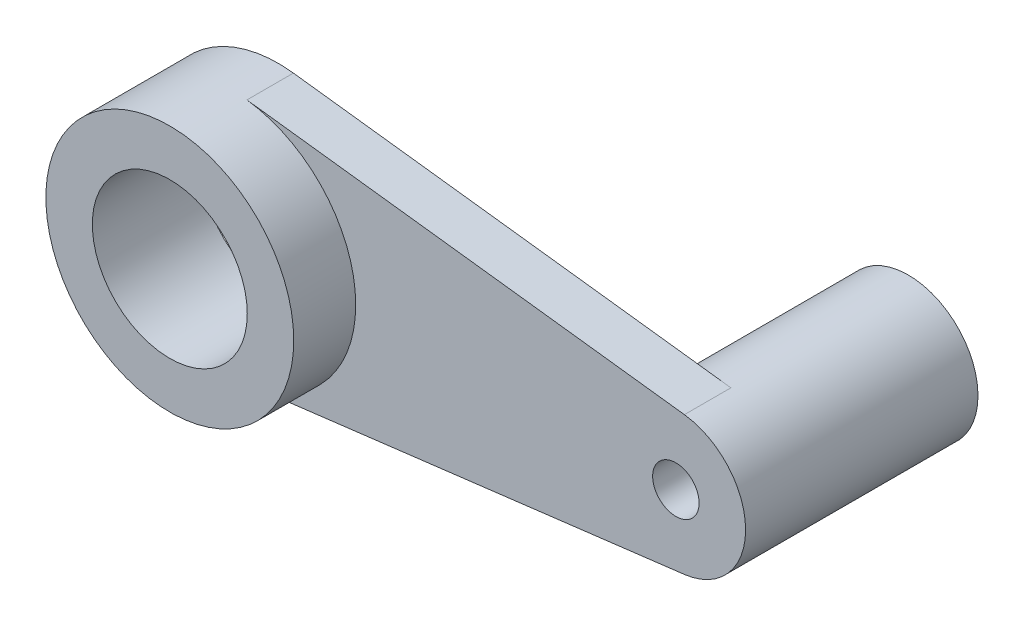
from build123d import *

# Parameters (mm, degrees)
SKETCH3_R                = 10
BOSS_EXTRUDE4_DEPTH      = 14
BOSS_EXTRUDE5_DEPTH      = 6
BOSS_EXTRUDE6_DEPTH      = 6
BOSS_EXTRUDE6_DEPTH_BACK = 24
SKETCH3_4_R              = 3


with BuildPart() as part:
    # Sketch3 → Boss-Extrude4 (new body)
    with BuildSketch(Plane.XY):
        with BuildLine():
            ThreePointArc((16, 0), (11.984506309, 10.600547558), (1.953548933, 15.880291136))
            ThreePointArc((1.953548933, 15.880291136), (-16, 0), (1.953548933, -15.880291136))
            ThreePointArc((1.953548933, -15.880291136), (11.984506309, -10.600547558), (16, 0))
        make_face()
        Circle(SKETCH3_R, mode=Mode.SUBTRACT)
    extrude(amount=BOSS_EXTRUDE4_DEPTH)

    # Sketch3<3> → Boss-Extrude5 (add)
    with BuildSketch(Plane.XY):
        with BuildLine():
            ThreePointArc((58.430427234, -8.932663764), (48.331555959, 0), (58.430427234, 8.932663764))
            Line((58.430427234, 8.932663764), (1.953548933, 15.880291136))
            ThreePointArc((1.953548933, 15.880291136), (11.984506309, 10.600547558), (16, 0))
            ThreePointArc((16, 0), (11.984506309, -10.600547558), (1.953548933, -15.880291136))
            Line((1.953548933, -15.880291136), (58.430427234, -8.932663764))
        make_face()
    extrude(amount=BOSS_EXTRUDE5_DEPTH)

    # Sketch3<4> → Boss-Extrude6 (add, two sides: drawn at the far end of the back side and taken through both)
    with BuildSketch(Plane.XY.offset(-BOSS_EXTRUDE6_DEPTH_BACK)):
        with BuildLine():
            ThreePointArc((66.331555959, 0), (64.072840758, 5.962808001), (58.430427234, 8.932663764))
            ThreePointArc((58.430427234, 8.932663764), (48.331555959, 0), (58.430427234, -8.932663764))
            ThreePointArc((58.430427234, -8.932663764), (64.072840758, -5.962808001), (66.331555959, 0))
        make_face()
        with Locations((57.331555959, 0)):
            Circle(SKETCH3_4_R, mode=Mode.SUBTRACT)
    extrude(amount=BOSS_EXTRUDE6_DEPTH + BOSS_EXTRUDE6_DEPTH_BACK)


solid = part.part
